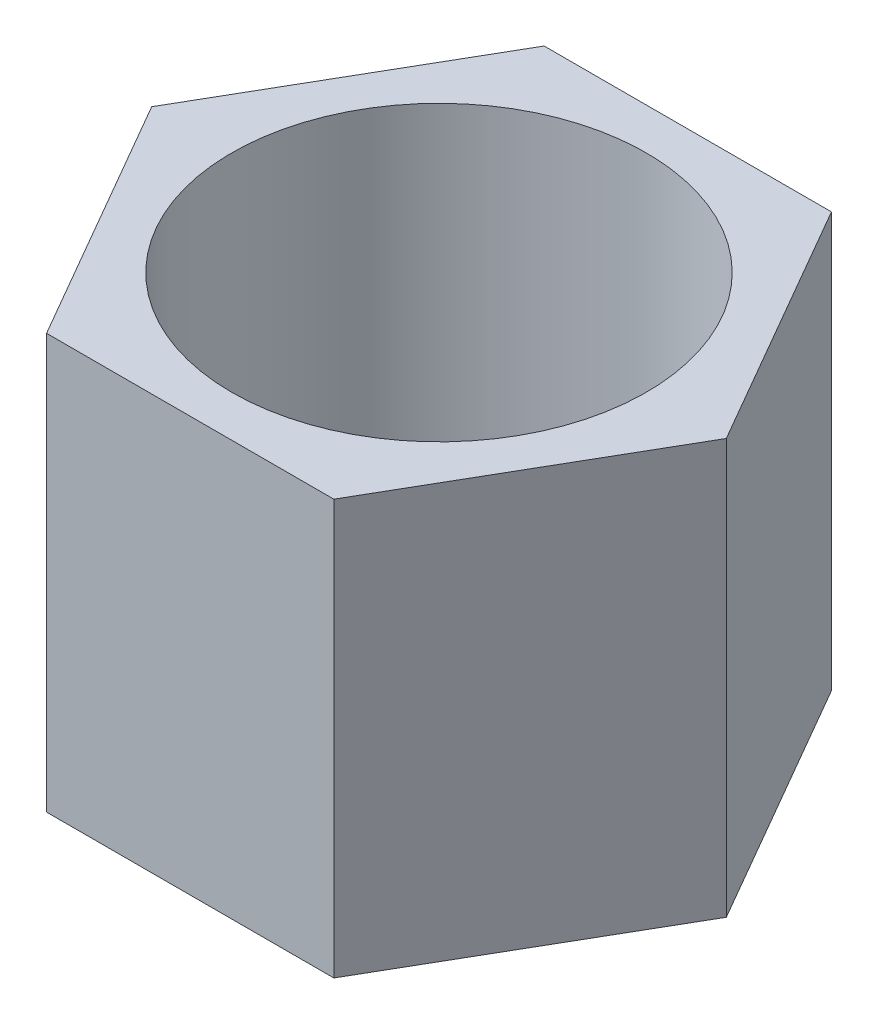
from build123d import *

# Parameters (mm, degrees)
SKETCH1_R           = 5
BOSS_EXTRUDE1_DEPTH = 10


with BuildPart() as part:
    # Sketch1 → Boss-Extrude1 (new body)
    with BuildSketch(Plane(origin=(0, 0, 0), x_dir=(1, 0, 0), z_dir=(0, 1, 0))):
        Polygon((6.92820323, 0), (3.464101615, 6), (-3.464101615, 6), (-6.92820323, 0), (-3.464101615, -6), (3.464101615, -6), align=None)
        with Locations(Location((0, 0, 0), (0, 0, 270))):
            Circle(SKETCH1_R, mode=Mode.SUBTRACT)
    extrude(amount=BOSS_EXTRUDE1_DEPTH)


solid = part.part
